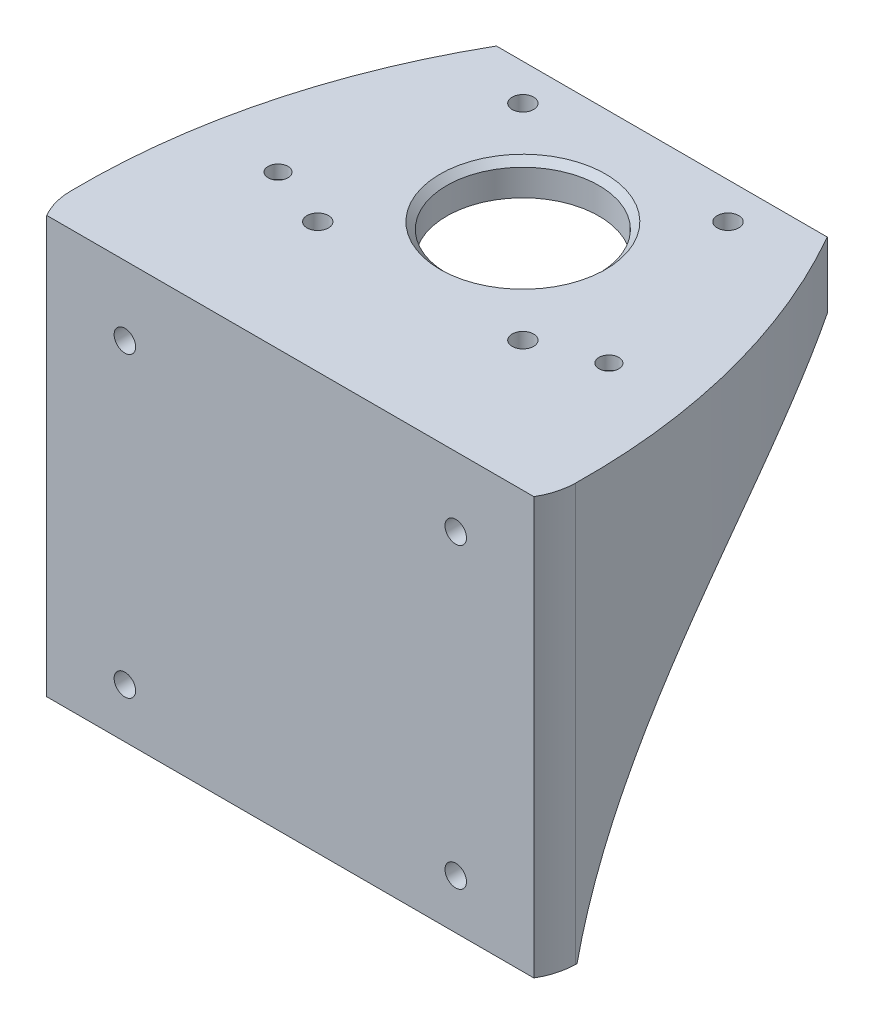
from build123d import *

# Parameters (mm, degrees)
ESQUISSE1_W                  = 62
ESQUISSE1_H                  = 60
BOSS_EXTRU_1_DEPTH           = 10
ESQUISSE3_R                  = 5
BOSS_EXTRU_2_DEPTH           = 5
ESQUISSE4_R                  = 3.5
BOSS_EXTRU_3_DEPTH           = 2
ESQUISSE5_R                  = 1.625
ENL_V_MAT_EXTRU_2_DEPTH      = 88.93747779
BOSS_EXTRU_4_DEPTH           = 3
ESQUISSE9_R                  = 11.5
ESQUISSE9_R_2                = 1.625
ESQUISSE9_R_3                = 1.5
ENL_V_MAT_EXTRU_4_DEPTH      = 10
BOSS_EXTRU_6_DEPTH           = 63
ENL_V_MAT_EXTRU_6_DEPTH      = 4
ENL_V_MAT_EXTRU_7_DEPTH      = 102
ENL_V_MAT_EXTRU_8_DEPTH      = 23
ENL_V_MAT_EXTRU_8_DEPTH_BACK = 1
ESQUISSE19_W                 = 42
ESQUISSE19_H                 = 42
CHANFREIN1_SIZE              = 1
CONG_1_R                     = 10
ESQUISSE20_W                 = 78.680458436
ESQUISSE20_H                 = 17.435551952
ENL_V_MAT_EXTRU_9_DEPTH      = 107.575890285


with BuildPart() as part:
    # Esquisse1 → Boss.-Extru.1 (new body)
    with BuildSketch(Plane.XY):
        with Locations((31, 30)):
            Rectangle(ESQUISSE1_W, ESQUISSE1_H)
    extrude(amount=BOSS_EXTRU_1_DEPTH)

    # Esquisse3 → Boss.-Extru.2 (add)
    with BuildSketch(Plane.XY.offset(10)):
        with Locations(Location((6, 52.5, 0), (0, 0, 180))):
            Circle(ESQUISSE3_R)
        with Locations(Location((56, 7.5, 0), (0, 0, 180))):
            Circle(ESQUISSE3_R)
        with Locations(Location((6, 7.5, 0), (0, 0, 180))):
            Circle(ESQUISSE3_R)
        with Locations(Location((56, 52.5, 0), (0, 0, 180))):
            Circle(ESQUISSE3_R)
    extrude(amount=BOSS_EXTRU_2_DEPTH)

    # Esquisse4 → Boss.-Extru.3 (add)
    with BuildSketch(Plane.XY.offset(15)):
        with Locations((6, 52.5)):
            Circle(ESQUISSE4_R)
        with Locations((56, 52.5)):
            Circle(ESQUISSE4_R)
        with Locations((56, 7.5)):
            Circle(ESQUISSE4_R)
        with Locations((6, 7.5)):
            Circle(ESQUISSE4_R)
    extrude(amount=BOSS_EXTRU_3_DEPTH)

    # Esquisse5 → Enlèv. mat.-Extru.2 (cut, through all)
    with BuildSketch(Plane.XY.offset(17)):
        with Locations((6, 52.5)):
            Circle(ESQUISSE5_R)
        with Locations((56, 52.5)):
            Circle(ESQUISSE5_R)
        with Locations((56, 7.5)):
            Circle(ESQUISSE5_R)
        with Locations((6, 7.5)):
            Circle(ESQUISSE5_R)
    extrude(amount=-ENL_V_MAT_EXTRU_2_DEPTH, mode=Mode.SUBTRACT)

    # Esquisse7 → Boss.-Extru.4 (add, symmetric)
    with BuildSketch(Plane(origin=(0, 60, 0), x_dir=(1, 0, 0), z_dir=(0, 1, 0))):
        with BuildLine():
            Line((0, 0), (0, -10))
            Line((0, -10), (62, -10))
            Line((62, -10), (62, 0))
            ThreePointArc((62, 0), (61.543258885, 25.799206928), (56, 51))
            Line((56, 51), (6, 51))
            ThreePointArc((6, 51), (0.456741115, 25.799206928), (0, 0))
        make_face()
    extrude(amount=BOSS_EXTRU_4_DEPTH, both=True)

    # Esquisse9 → Enlèv. mat.-Extru.4 (cut)
    with BuildSketch(Plane(origin=(0, 63, 0), x_dir=(1, 0, 0), z_dir=(0, 1, 0))):
        with Locations(Location((31, 30, 0), (0, 0, 270))):
            Circle(ESQUISSE9_R)
        with Locations(Location((46.5, 14.5, 0), (0, 0, 270))):
            Circle(ESQUISSE9_R_2)
        with Locations(Location((15.5, 14.5, 0), (0, 0, 270))):
            Circle(ESQUISSE9_R_2)
        with Locations(Location((15.5, 45.5, 0), (0, 0, 270))):
            Circle(ESQUISSE9_R_2)
        with Locations(Location((46.5, 45.5, 0), (0, 0, 270))):
            Circle(ESQUISSE9_R_2)
        with Locations(Location((56, 18, 0), (0, 0, 270))):
            Circle(ESQUISSE9_R_3)
        with Locations(Location((6, 18, 0), (0, 0, 270))):
            Circle(ESQUISSE9_R_3)
    extrude(amount=-ENL_V_MAT_EXTRU_4_DEPTH, mode=Mode.SUBTRACT)

    # Esquisse14 → Boss.-Extru.6 (add)
    with BuildSketch(Plane(origin=(0, 63, 0), x_dir=(1, 0, 0), z_dir=(0, 1, 0))):
        with BuildLine():
            Line((0, 0), (0, -10))
            Line((0, -10), (-6.92820323, -6))
            ThreePointArc((-6.92820323, -6), (-4.721429116, 23.465606932), (6, 51))
            Line((6, 51), (11.044473074, 51))
            ThreePointArc((11.044473074, 51), (2.937001082, 26.059854184), (0, 0))
        make_face()
    boss_extru_6 = extrude(amount=-BOSS_EXTRU_6_DEPTH)

    # Symétrie1: Boss.-Extru.6 across plane
    add(boss_extru_6.mirror(Plane(origin=(31, 0, 0), x_dir=(0, 0, 1), z_dir=(1, 0, 0))))

    # Esquisse16 → Enlèv. mat.-Extru.6 (cut)
    with BuildSketch(Plane.XZ.offset(-57)):
        Polygon((10.041451884, -18), (8.020725942, -14.5), (3.979274058, -14.5), (1.958548116, -18), (3.979274058, -21.5), (8.020725942, -21.5), align=None)
        Polygon((60.041451884, -18), (58.020725942, -14.5), (53.979274058, -14.5), (51.958548116, -18), (53.979274058, -21.5), (58.020725942, -21.5), align=None)
    extrude(amount=-ENL_V_MAT_EXTRU_6_DEPTH, mode=Mode.SUBTRACT)

    # Esquisse18 → Enlèv. mat.-Extru.7 (cut, symmetric)
    with BuildSketch(Plane(origin=(0, 0, 0), x_dir=(0, 0, -1), z_dir=(1, 0, 0))):
        with BuildLine():
            Line((51, 53), (51, 0))
            Line((51, 0), (0, 0))
            ThreePointArc((0, 0), (17.977874458, 33.738271748), (51, 53))
        make_face()
    extrude(amount=ENL_V_MAT_EXTRU_7_DEPTH, both=True, mode=Mode.SUBTRACT)

    # Esquisse19 → Enlèv. mat.-Extru.8 (cut, two sides: drawn at the far end of the back side and taken through both)
    with BuildSketch(Plane.XZ.offset(-57).offset(-ENL_V_MAT_EXTRU_8_DEPTH_BACK)):
        with Locations((31, -30)):
            Rectangle(ESQUISSE19_W, ESQUISSE19_H)
    extrude(amount=ENL_V_MAT_EXTRU_8_DEPTH + ENL_V_MAT_EXTRU_8_DEPTH_BACK, mode=Mode.SUBTRACT)

    # Chanfrein1
    chanfrein1_edges = [part.edges().sort_by_distance(p)[0] for p in [
        (31, 63, -41.5),
    ]]
    chamfer(chanfrein1_edges, length=CHANFREIN1_SIZE)

    # Congé1
    cong_1_edges = [part.edges().sort_by_distance(p)[0] for p in [
        (-6.92820323, 31.5, 6),
        (68.92820323, 31.5, 6),
    ]]
    fillet(cong_1_edges, radius=CONG_1_R)

    # Esquisse20 → Enlèv. mat.-Extru.9 (cut, through all)
    with BuildSketch(Plane(origin=(0, 63, 0), x_dir=(1, 0, 0), z_dir=(0, 1, 0))):
        with Locations((28.467372623, -13.863092679)):
            Rectangle(ESQUISSE20_W, ESQUISSE20_H)
    extrude(amount=-ENL_V_MAT_EXTRU_9_DEPTH, mode=Mode.SUBTRACT)


solid = part.part
